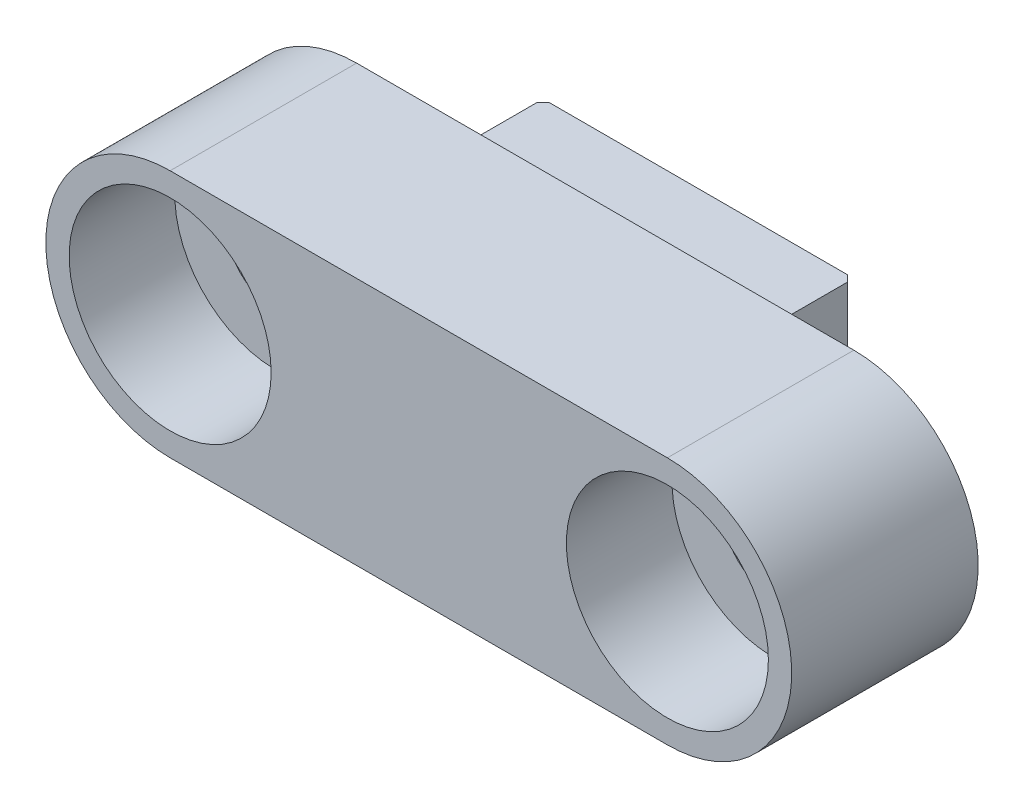
from build123d import *

# Parameters (mm, degrees)
BOSS_EXTRU_1_DEPTH                                 = 6
CHAMBRAGE_POUR_VIS_T_TE_HEXAGONALE_M31_D           = 3.2
CHAMBRAGE_POUR_VIS_T_TE_HEXAGONALE_M31_CBORE_D     = 6.5
CHAMBRAGE_POUR_VIS_T_TE_HEXAGONALE_M31_CBORE_DEPTH = 3.4
ESQUISSE6_W                                        = 10
ESQUISSE6_H                                        = 8
BOSS_EXTRU_2_DEPTH                                 = 3
CHANFREIN1_SIZE                                    = 0.2
ENL_V_MAT_EXTRU_5_REACH                            = 20.466
ESQUISSE10_W                                       = 3
ESQUISSE10_H                                       = 1


with BuildPart() as part:
    # Esquisse1 → Boss.-Extru.1 (new body)
    with BuildSketch(Plane.XY):
        with BuildLine():
            Line((-8, 4), (8, 4))
            ThreePointArc((8, 4), (12, 0), (8, -4))
            Line((8, -4), (-8, -4))
            ThreePointArc((-8, -4), (-12, 0), (-8, 4))
        make_face()
    extrude(amount=BOSS_EXTRU_1_DEPTH)

    # Chambrage pour vis à tête hexagonale M31 (through all)
    with Locations(Plane.XY.offset(6)):
        with Locations((-8, 0), (8, 0)):
            CounterBoreHole(CHAMBRAGE_POUR_VIS_T_TE_HEXAGONALE_M31_D / 2, CHAMBRAGE_POUR_VIS_T_TE_HEXAGONALE_M31_CBORE_D / 2, CHAMBRAGE_POUR_VIS_T_TE_HEXAGONALE_M31_CBORE_DEPTH)

    # Esquisse6 → Boss.-Extru.2 (add)
    with BuildSketch(Plane(origin=(0, 0, 0), x_dir=(-1, 0, 0), z_dir=(0, 0, -1))):
        Rectangle(ESQUISSE6_W, ESQUISSE6_H)
    extrude(amount=BOSS_EXTRU_2_DEPTH)

    # Chanfrein1
    chanfrein1_edges = [part.edges().sort_by_distance(p)[0] for p in [
        (5, 0, -3),
        (-5, 0, -3),
    ]]
    chamfer(chanfrein1_edges, length=CHANFREIN1_SIZE)

    # Esquisse10 → Enlèv. mat.-Extru.5 (cut, up to next)
    with BuildSketch(Plane(origin=(5, 0, 0), x_dir=(0, 0, -1), z_dir=(1, 0, 0)), mode=Mode.PRIVATE) as enl_v_mat_extru_5_sk1:
        with Locations((1.5, 3.5)):
            Rectangle(ESQUISSE10_W, ESQUISSE10_H)
    enl_v_mat_extru_5_tool1 = extrude(enl_v_mat_extru_5_sk1.sketch, amount=-ENL_V_MAT_EXTRU_5_REACH, mode=Mode.PRIVATE) & part.part
    # Esquisse10 → Enlèv. mat.-Extru.5 (cut, up to next)
    with BuildSketch(Plane(origin=(5, 0, 0), x_dir=(0, 0, -1), z_dir=(1, 0, 0)), mode=Mode.PRIVATE) as enl_v_mat_extru_5_sk2:
        with Locations((1.5, -3.5)):
            Rectangle(ESQUISSE10_W, ESQUISSE10_H)
    enl_v_mat_extru_5_tool2 = extrude(enl_v_mat_extru_5_sk2.sketch, amount=-ENL_V_MAT_EXTRU_5_REACH, mode=Mode.PRIVATE) & part.part
    add(enl_v_mat_extru_5_tool1.solids().sort_by_distance((5, 3.5, -1.5))[0], mode=Mode.SUBTRACT)
    add(enl_v_mat_extru_5_tool2.solids().sort_by_distance((5, -3.5, -1.5))[0], mode=Mode.SUBTRACT)


solid = part.part
